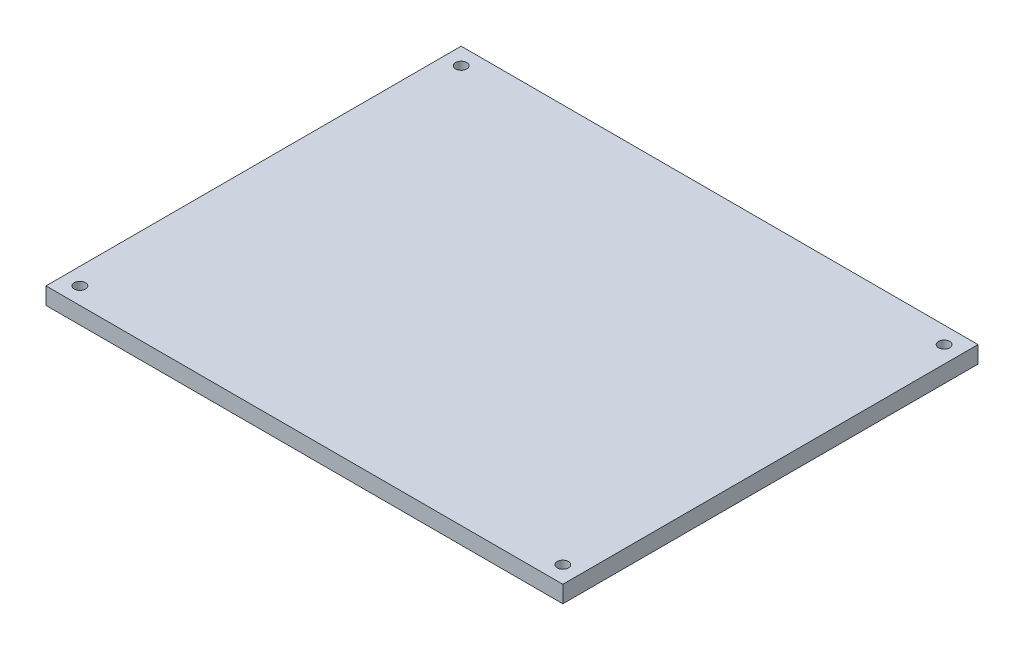
from build123d import *

# Parameters (mm, degrees)
PLATE_START      = -40
SKETCH1_W        = 245
SKETCH1_H        = 10
PLATE_DEPTH      = 305
EXTRUDE_START    = -12
SKETCH2_R        = 3.3
EXTRUDE_H0_DEPTH = 14
SKETCH3_R        = 3.3
EXTRUDE_H1_DEPTH = 14
SKETCH4_R        = 3.3
EXTRUDE_H2_DEPTH = 14
SKETCH5_R        = 3.3
EXTRUDE_H3_DEPTH = 14


with BuildPart() as part:
    # Sketch1 → plate (new body)
    with BuildSketch(Plane(origin=(0, 0, 0), x_dir=(0, 0, -1), z_dir=(1, 0, 0)).offset(PLATE_START)):
        with Locations((-12.5, -5)):
            Rectangle(SKETCH1_W, SKETCH1_H)
    extrude(amount=PLATE_DEPTH)


with BuildPart() as body_2:
    # Sketch2 → Extrude h0 (new body)
    with BuildSketch(Plane(origin=(0, 0, 0), x_dir=(1, 0, 0), z_dir=(0, 1, 0)).offset(EXTRUDE_START)):
        with Locations((-30, 100)):
            Circle(SKETCH2_R)
    extrude(amount=EXTRUDE_H0_DEPTH)


with BuildPart() as part_1:
    add(part.part)

    # Combine1: cut body 2
    add(body_2.part, mode=Mode.SUBTRACT)


with BuildPart() as body_2_2:
    # Sketch3 → Extrude h1 (new body)
    with BuildSketch(Plane(origin=(0, 0, 0), x_dir=(1, 0, 0), z_dir=(0, 1, 0)).offset(EXTRUDE_START)):
        with Locations((-30, -125)):
            Circle(SKETCH3_R)
    extrude(amount=EXTRUDE_H1_DEPTH)


with BuildPart() as part_2:
    add(part_1.part)

    # Combine2: cut body 2 2
    add(body_2_2.part, mode=Mode.SUBTRACT)


with BuildPart() as body_2_3:
    # Sketch4 → Extrude h2 (new body)
    with BuildSketch(Plane(origin=(0, 0, 0), x_dir=(1, 0, 0), z_dir=(0, 1, 0)).offset(EXTRUDE_START)):
        with Locations((255, 100)):
            Circle(SKETCH4_R)
    extrude(amount=EXTRUDE_H2_DEPTH)


with BuildPart() as part_3:
    add(part_2.part)

    # Combine3: cut body 2 3
    add(body_2_3.part, mode=Mode.SUBTRACT)


with BuildPart() as body_2_4:
    # Sketch5 → Extrude h3 (new body)
    with BuildSketch(Plane(origin=(0, 0, 0), x_dir=(1, 0, 0), z_dir=(0, 1, 0)).offset(EXTRUDE_START)):
        with Locations((255, -125)):
            Circle(SKETCH5_R)
    extrude(amount=EXTRUDE_H3_DEPTH)


with BuildPart() as part_4:
    add(part_3.part)

    # Combine4: cut body 2 4
    add(body_2_4.part, mode=Mode.SUBTRACT)


solid = part_4.part
